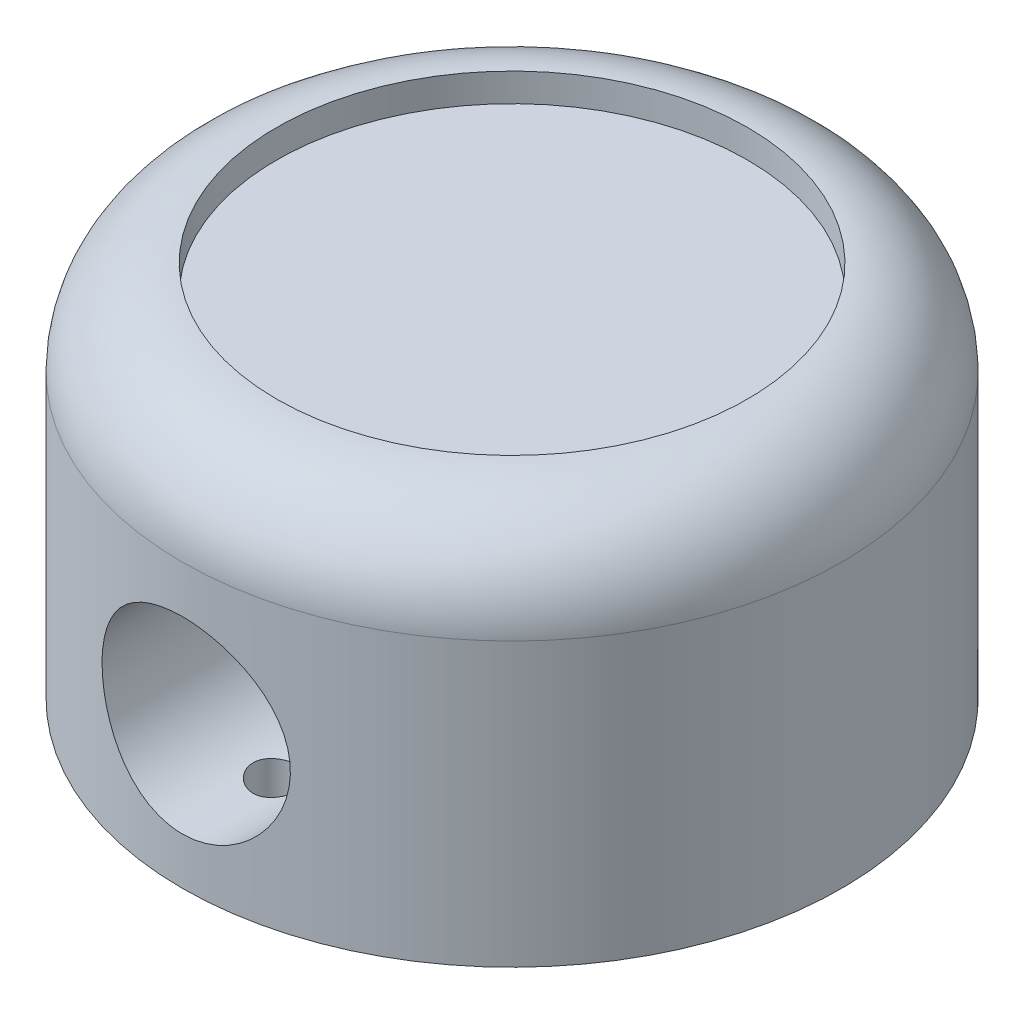
from build123d import *

# Parameters (mm, degrees)
ESQUISSE2_R             = 35
BOSS_EXTRU_1_DEPTH      = 40
CONG_1_R                = 10
ESQUISSE3_R             = 20
ENL_V_MAT_EXTRU_1_DEPTH = 30
ESQUISSE7_R             = 25
ENL_V_MAT_EXTRU_3_DEPTH = 3
ESQUISSE8_R             = 10
ENL_V_MAT_EXTRU_4_DEPTH = 45
ESQUISSE4_R             = 2.5
ENL_V_MAT_EXTRU_5_DEPTH = 30
ESQUISSE9_R             = 1.5
ENL_V_MAT_EXTRU_6_DEPTH = 16


with BuildPart() as part:
    # Esquisse2 → Boss.-Extru.1 (new body)
    with BuildSketch(Plane(origin=(0, 0, 0), x_dir=(1, 0, 0), z_dir=(0, 1, 0))):
        with Locations(Location((0, 0, 0), (0, 0, 270))):
            Circle(ESQUISSE2_R)
    extrude(amount=BOSS_EXTRU_1_DEPTH)

    # Congé1
    cong_1_edges = [part.edges().sort_by_distance(p)[0] for p in [
        (0, 40, -35),
    ]]
    fillet(cong_1_edges, radius=CONG_1_R)

    # Esquisse3 → Enlèv. mat.-Extru.1 (cut)
    with BuildSketch(Plane.XZ):
        with Locations(Location((0, 0, 0), (0, 0, 270))):
            Circle(ESQUISSE3_R)
    extrude(amount=-ENL_V_MAT_EXTRU_1_DEPTH, mode=Mode.SUBTRACT)

    # Esquisse7 → Enlèv. mat.-Extru.3 (cut)
    with BuildSketch(Plane(origin=(0, 40, 0), x_dir=(1, 0, 0), z_dir=(0, 1, 0))):
        with Locations(Location((0, 0, 0), (0, 0, 270))):
            Circle(ESQUISSE7_R)
    extrude(amount=-ENL_V_MAT_EXTRU_3_DEPTH, mode=Mode.SUBTRACT)

    # Esquisse8 → Enlèv. mat.-Extru.4 (cut)
    with BuildSketch(Plane.XY):
        with Locations(Location((0, 15, 0), (0, 0, 180))):
            Circle(ESQUISSE8_R)
    extrude(amount=ENL_V_MAT_EXTRU_4_DEPTH, mode=Mode.SUBTRACT)

    # Esquisse4 → Enlèv. mat.-Extru.5 (cut)
    with BuildSketch(Plane.XZ):
        with Locations(Location((0, 25, 0), (0, 0, 270))):
            Circle(ESQUISSE4_R)
    extrude(amount=-ENL_V_MAT_EXTRU_5_DEPTH, mode=Mode.SUBTRACT)

    # Esquisse9 → Enlèv. mat.-Extru.6 (cut)
    with BuildSketch(Plane.XZ):
        with Locations(Location((-27.5, 0, 0), (0, 0, 270))):
            Circle(ESQUISSE9_R)
        with Locations(Location((27.5, 0, 0), (0, 0, 270))):
            Circle(ESQUISSE9_R)
    extrude(amount=-ENL_V_MAT_EXTRU_6_DEPTH, mode=Mode.SUBTRACT)


solid = part.part
